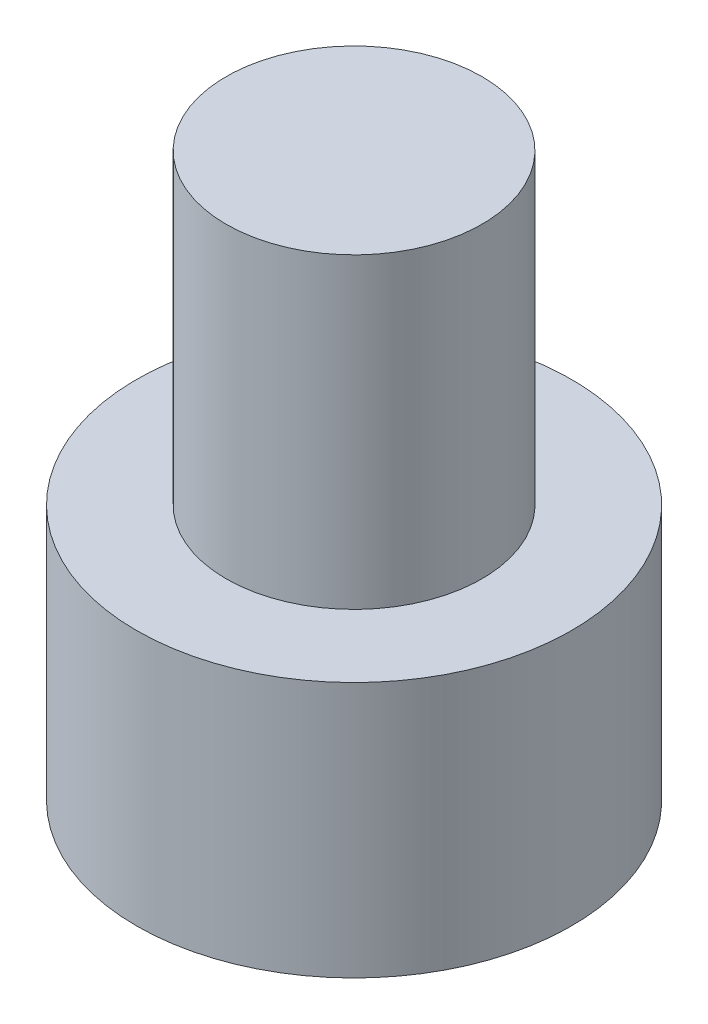
from build123d import *

# Parameters (mm, degrees)
SKETCH_2_W          = 4.25
SKETCH_2_H          = 5
SKETCH_3_R          = 2.5
EXTRUDE_1_DEPTH     = 6
CUT_EXTRUDE_1_DEPTH = 1


with BuildPart() as part:
    # 草图2 → 旋转1 (revolve)
    with BuildSketch(Plane(origin=(0, 0, 0), x_dir=(-1, 0, 0), z_dir=(0, 0, -1)), mode=Mode.PRIVATE) as revolve_1_sk:
        with Locations((-2.125, -2.5)):
            Rectangle(SKETCH_2_W, SKETCH_2_H)
    revolve(revolve_1_sk.sketch.rotate(Axis((0, -5, 0), (0, 1, 0)), 270), axis=Axis((0, -5, 0), (0, 1, 0)))

    # 草图3 → 凸台-拉伸1 (add)
    with BuildSketch(Plane(origin=(0, 0, 0), x_dir=(-1, 0, 0), z_dir=(0, 1, 0))):
        with Locations(Location((0, 0, 0), (0, 0, 90))):
            Circle(SKETCH_3_R)
    extrude(amount=EXTRUDE_1_DEPTH)

    # 草图4 → 切除-拉伸1 (cut)
    with BuildSketch(Plane.XZ.offset(5)):
        Polygon((-1.154700538, -2), (1.154700538, -2), (2.309401077, 0), (1.154700538, 2), (-1.154700538, 2), (-2.309401077, 0), align=None)
    extrude(amount=-CUT_EXTRUDE_1_DEPTH, mode=Mode.SUBTRACT)


solid = part.part
